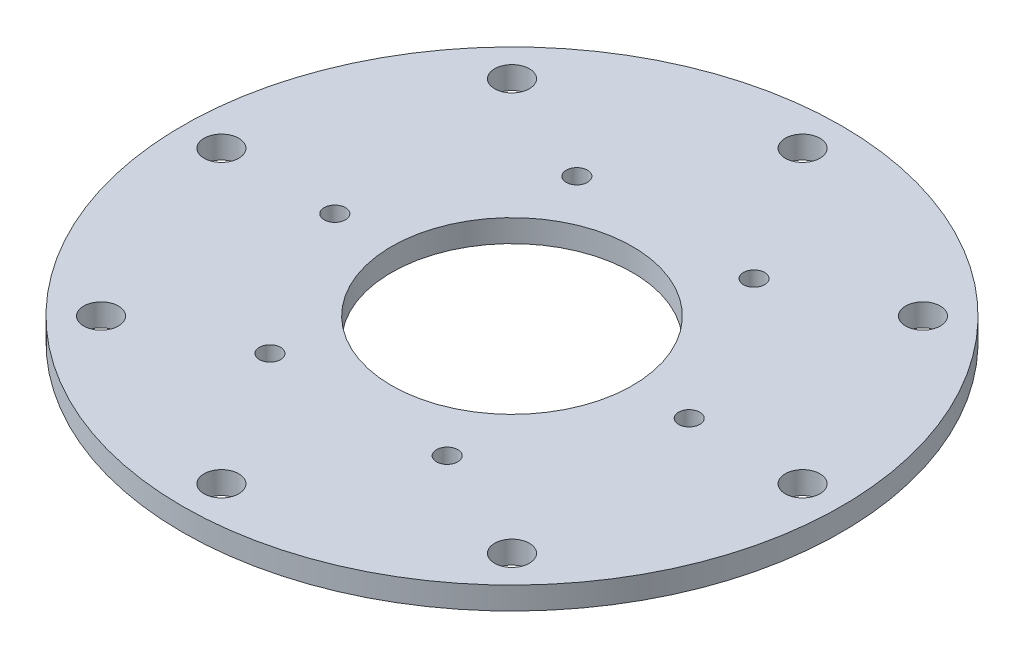
from build123d import *

# Parameters (mm, degrees)
SKETCH2_R           = 46.5
SKETCH2_R_2         = 17
SKETCH2_R_3         = 2.45
SKETCH2_R_4         = 1.5
BOSS_EXTRUDE1_DEPTH = 3.175


with BuildPart() as part:
    # Sketch2 → Boss-Extrude1 (new body)
    with BuildSketch(Plane(origin=(0, 0, 0), x_dir=(1, 0, 0), z_dir=(0, 1, 0))):
        with Locations(Location((0, 0, 0), (0, 0, 270))):
            Circle(SKETCH2_R)
        with Locations(Location((0, 0, 0), (0, 0, 270))):
            Circle(SKETCH2_R_2, mode=Mode.SUBTRACT)
        with Locations(Location((-41, 0, 0), (0, 0, 270))):
            Circle(SKETCH2_R_3, mode=Mode.SUBTRACT)
        with Locations(Location((-25, 0, 0), (0, 0, 270))):
            Circle(SKETCH2_R_4, mode=Mode.SUBTRACT)
        with Locations(Location((-12.5, 21.650635095, 0), (0, 0, 270))):
            Circle(SKETCH2_R_4, mode=Mode.SUBTRACT)
        with Locations(Location((12.5, 21.650635095, 0), (0, 0, 270))):
            Circle(SKETCH2_R_4, mode=Mode.SUBTRACT)
        with Locations(Location((25, 0, 0), (0, 0, 270))):
            Circle(SKETCH2_R_4, mode=Mode.SUBTRACT)
        with Locations(Location((12.5, -21.650635095, 0), (0, 0, 270))):
            Circle(SKETCH2_R_4, mode=Mode.SUBTRACT)
        with Locations(Location((-12.5, -21.650635095, 0), (0, 0, 270))):
            Circle(SKETCH2_R_4, mode=Mode.SUBTRACT)
        with Locations(Location((-28.991378029, 28.991378029, 0), (0, 0, 270))):
            Circle(SKETCH2_R_3, mode=Mode.SUBTRACT)
        with Locations(Location((0, 41, 0), (0, 0, 270))):
            Circle(SKETCH2_R_3, mode=Mode.SUBTRACT)
        with Locations(Location((28.991378029, 28.991378029, 0), (0, 0, 270))):
            Circle(SKETCH2_R_3, mode=Mode.SUBTRACT)
        with Locations(Location((41, 0, 0), (0, 0, 270))):
            Circle(SKETCH2_R_3, mode=Mode.SUBTRACT)
        with Locations(Location((28.991378029, -28.991378029, 0), (0, 0, 270))):
            Circle(SKETCH2_R_3, mode=Mode.SUBTRACT)
        with Locations(Location((0, -41, 0), (0, 0, 270))):
            Circle(SKETCH2_R_3, mode=Mode.SUBTRACT)
        with Locations(Location((-28.991378029, -28.991378029, 0), (0, 0, 270))):
            Circle(SKETCH2_R_3, mode=Mode.SUBTRACT)
    extrude(amount=BOSS_EXTRUDE1_DEPTH)


solid = part.part
